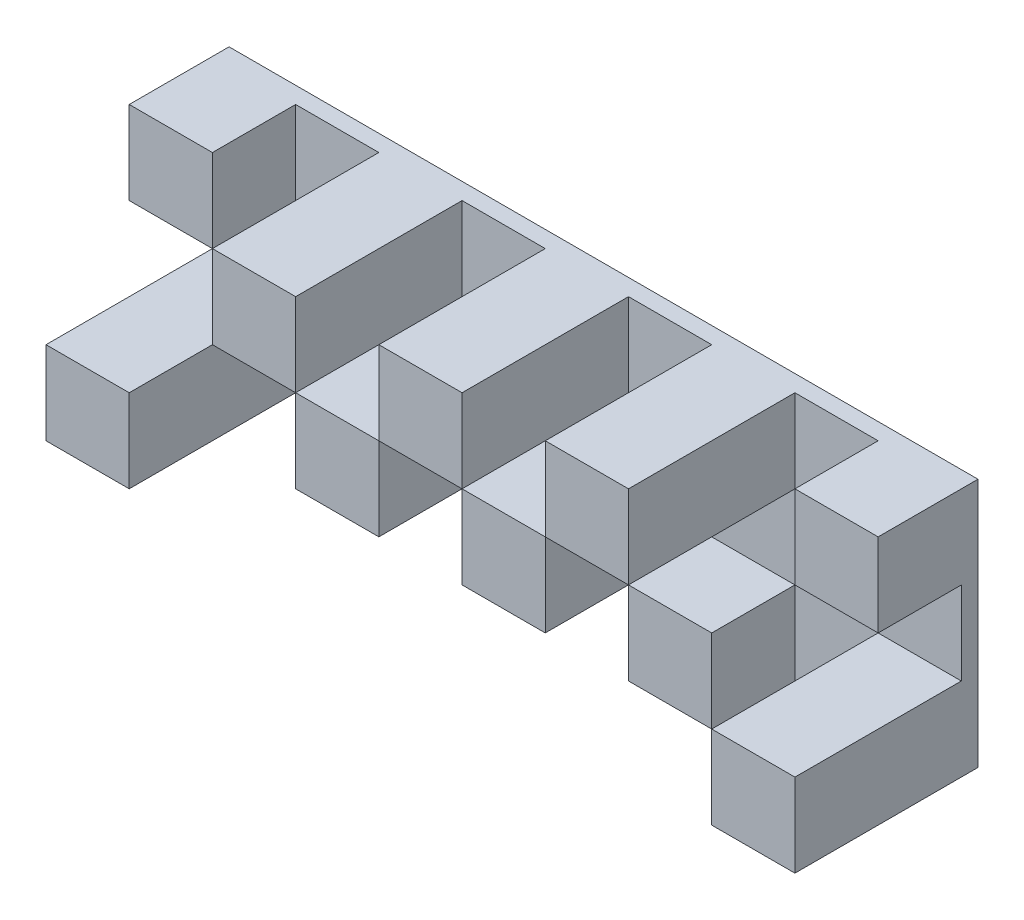
from build123d import *

# Parameters (mm, degrees)
SKETCH2_W           = 450000
SKETCH2_H           = 150000
BOSS_EXTRUDE2_DEPTH = 10000
SKETCH4_W           = 50000
SKETCH4_H           = 50000
BOSS_EXTRUDE5_DEPTH = 100000
SKETCH5_W           = 50000
SKETCH5_H           = 50000
BOSS_EXTRUDE6_DEPTH = 50000


with BuildPart() as part:
    # Sketch2 → Boss-Extrude2 (new body)
    with BuildSketch(Plane.XY):
        with Locations((225000, 75000)):
            Rectangle(SKETCH2_W, SKETCH2_H)
    extrude(amount=BOSS_EXTRUDE2_DEPTH)

    # Sketch4 → Boss-Extrude5 (add)
    with BuildSketch(Plane.XY.offset(10000)):
        with Locations((225000, 124999.999999999)):
            Rectangle(SKETCH4_W, SKETCH4_H)
        with Locations((325000, 125000)):
            Rectangle(SKETCH4_W, SKETCH4_H)
        with Locations((425000, 25000)):
            Rectangle(SKETCH4_W, SKETCH4_H)
        with Locations((25000, 25000)):
            Rectangle(SKETCH4_W, SKETCH4_H)
        with Locations((125000, 124999.999999999)):
            Rectangle(SKETCH4_W, SKETCH4_H)
    extrude(amount=BOSS_EXTRUDE5_DEPTH)

    # Sketch5 → Boss-Extrude6 (add)
    with BuildSketch(Plane.XY.offset(10000)):
        with Locations((325000, 25000)):
            Rectangle(SKETCH5_W, SKETCH5_H)
        with Locations((225000, 25000)):
            Rectangle(SKETCH5_W, SKETCH5_H)
        with Locations((125000, 25000)):
            Rectangle(SKETCH5_W, SKETCH5_H)
        with Locations((25000, 125000)):
            Rectangle(SKETCH5_W, SKETCH5_H)
        with Locations((425000, 125000)):
            Rectangle(SKETCH5_W, SKETCH5_H)
    extrude(amount=BOSS_EXTRUDE6_DEPTH)


solid = part.part
